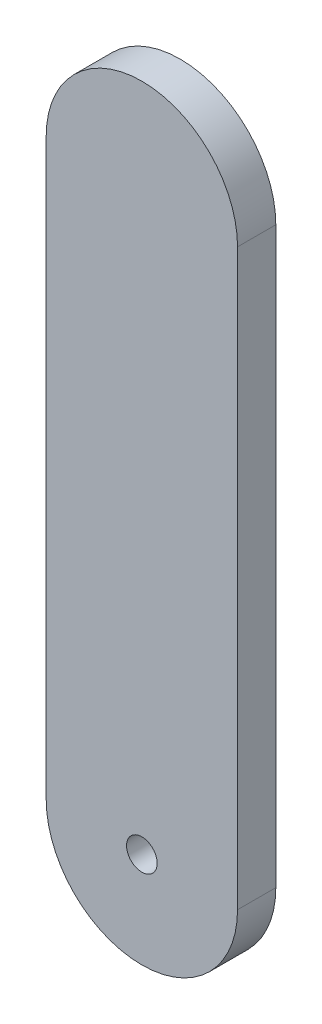
from build123d import *

# Parameters (mm, degrees)
BOSS_EXTRUDE1_DEPTH = 10
SKETCH3_R           = 4
CUT_EXTRUDE1_DEPTH  = 10


with BuildPart() as part:
    # Sketch2 → Boss-Extrude1 (new body)
    with BuildSketch(Plane.XY):
        with BuildLine():
            Line((25, 0), (25, 150))
            ThreePointArc((25, 150), (0, 175), (-25, 150))
            Line((-25, 150), (-25, 0))
            ThreePointArc((-25, 0), (0, -25), (25, 0))
        make_face()
    extrude(amount=BOSS_EXTRUDE1_DEPTH)

    # Sketch3 → Cut-Extrude1 (cut)
    with BuildSketch(Plane(origin=(0, 0, 0), x_dir=(-1, 0, 0), z_dir=(0, 0, -1))):
        Circle(SKETCH3_R)
    extrude(amount=-CUT_EXTRUDE1_DEPTH, mode=Mode.SUBTRACT)


solid = part.part
